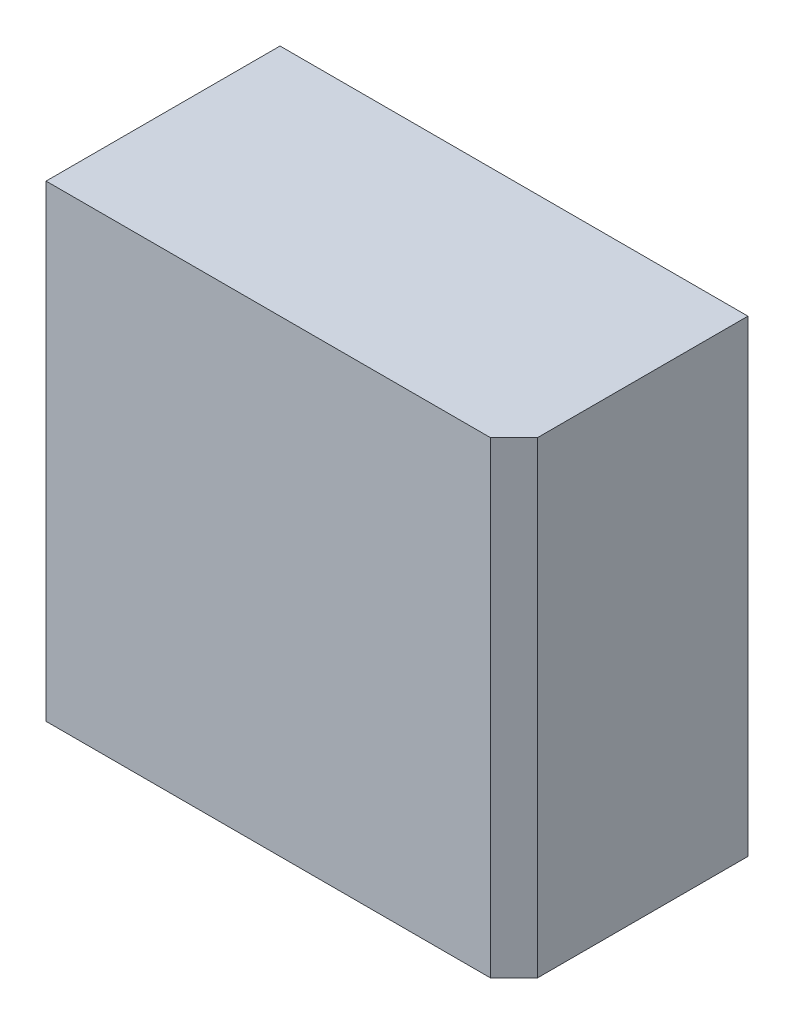
from build123d import *

# Parameters (mm, degrees)
SKIZZE1_W                       = 100
SKIZZE1_H                       = 100
AUFSATZ_LINEAR_AUSTRAGEN1_DEPTH = 50
FASE1_SIZE                      = 5


with BuildPart() as part:
    # Skizze1 → Aufsatz-Linear austragen1 (new body)
    with BuildSketch(Plane.XY):
        Rectangle(SKIZZE1_W, SKIZZE1_H)
    extrude(amount=AUFSATZ_LINEAR_AUSTRAGEN1_DEPTH)

    # Fase1
    fase1_edges = [part.edges().sort_by_distance(p)[0] for p in [
        (50, 0, 50),
    ]]
    chamfer(fase1_edges, length=FASE1_SIZE)


solid = part.part
